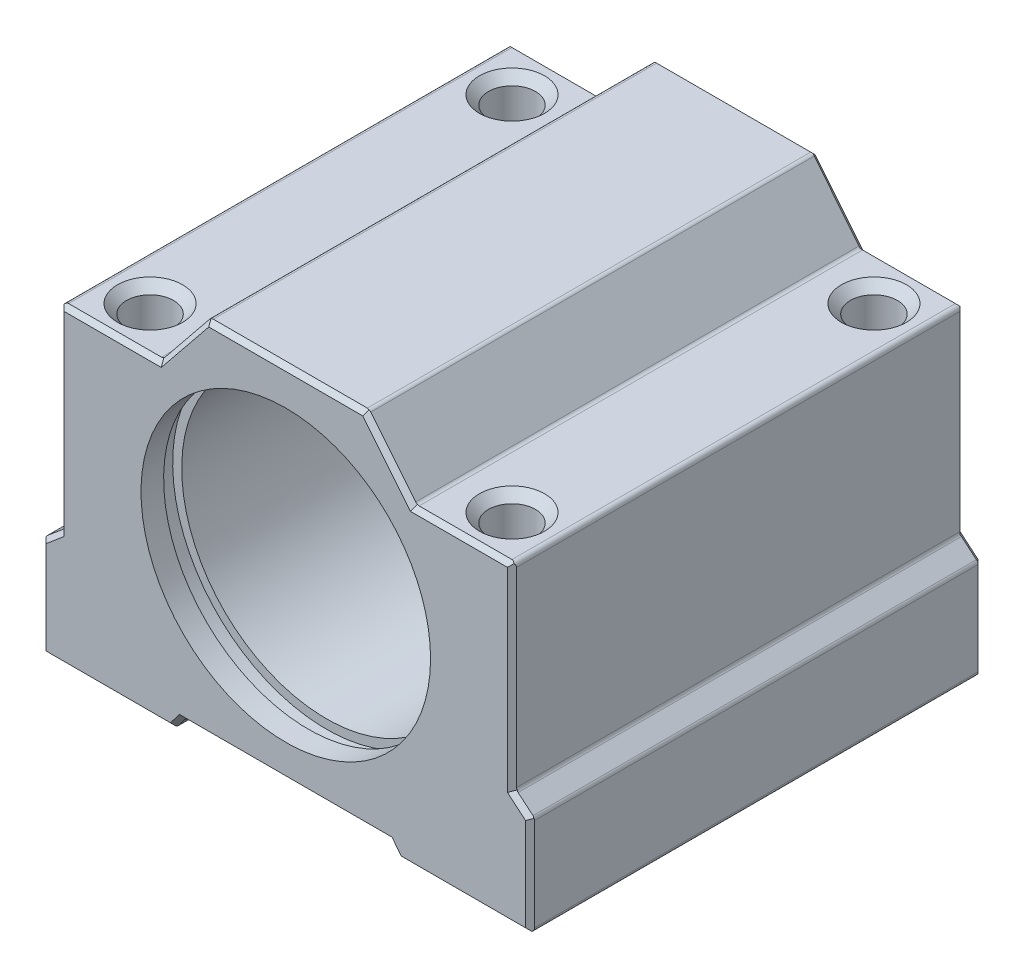
from build123d import *

# Parameters (mm, degrees)
SKETCH1_R           = 16
BOSS_EXTRUDE1_DEPTH = 50
CUT_EXTRUDE1_REACH  = 72.071
SKETCH2_R           = 2.6
SKETCH3_R           = 3
CUT_EXTRUDE2_DEPTH  = 12
SKETCH4_W           = 2
SKETCH4_H           = 1
CHAMFER1_SIZE       = 1
CHAMFER2_SIZE       = 0.5
FILLET2_R           = 0.5


with BuildPart() as part:
    # Sketch1 → Boss-Extrude1 (new body)
    with BuildSketch(Plane.XY):
        Polygon((8.75, 0), (-8.75, 0), (-14, -6.5), (-25, -6.5), (-25, -28.31372549), (-27, -30), (-27, -41), (-12.5, -41), (-11.5, -39.7), (11.5, -39.7), (12.5, -41), (27, -41), (27, -30), (25, -28.31372549), (25, -6.5), (14, -6.5), align=None)
        with Locations((0, -20)):
            Circle(SKETCH1_R, mode=Mode.SUBTRACT)
    extrude(amount=BOSS_EXTRUDE1_DEPTH)

    # Sketch2 → Cut-Extrude1 (cut, up to next)
    with BuildSketch(Plane(origin=(0, 0, 0), x_dir=(1, 0, 0), z_dir=(0, 1, 0)), mode=Mode.PRIVATE) as cut_extrude1_sk1:
        with Locations(Location((-20, -45, 0), (0, 0, 270))):
            Circle(SKETCH2_R)
    cut_extrude1_tool1 = extrude(cut_extrude1_sk1.sketch, amount=-CUT_EXTRUDE1_REACH, mode=Mode.PRIVATE) & part.part
    # Sketch2 → Cut-Extrude1 (cut, up to next)
    with BuildSketch(Plane(origin=(0, 0, 0), x_dir=(1, 0, 0), z_dir=(0, 1, 0)), mode=Mode.PRIVATE) as cut_extrude1_sk2:
        with Locations(Location((20, -45, 0), (0, 0, 270))):
            Circle(SKETCH2_R)
    cut_extrude1_tool2 = extrude(cut_extrude1_sk2.sketch, amount=-CUT_EXTRUDE1_REACH, mode=Mode.PRIVATE) & part.part
    # Sketch2 → Cut-Extrude1 (cut, up to next)
    with BuildSketch(Plane(origin=(0, 0, 0), x_dir=(1, 0, 0), z_dir=(0, 1, 0)), mode=Mode.PRIVATE) as cut_extrude1_sk3:
        with Locations(Location((20, -5, 0), (0, 0, 270))):
            Circle(SKETCH2_R)
    cut_extrude1_tool3 = extrude(cut_extrude1_sk3.sketch, amount=-CUT_EXTRUDE1_REACH, mode=Mode.PRIVATE) & part.part
    # Sketch2 → Cut-Extrude1 (cut, up to next)
    with BuildSketch(Plane(origin=(0, 0, 0), x_dir=(1, 0, 0), z_dir=(0, 1, 0)), mode=Mode.PRIVATE) as cut_extrude1_sk4:
        with Locations(Location((-20, -5, 0), (0, 0, 270))):
            Circle(SKETCH2_R)
    cut_extrude1_tool4 = extrude(cut_extrude1_sk4.sketch, amount=-CUT_EXTRUDE1_REACH, mode=Mode.PRIVATE) & part.part
    add(cut_extrude1_tool1.solids().sort_by_distance((-20, 0, 45))[0], mode=Mode.SUBTRACT)
    add(cut_extrude1_tool2.solids().sort_by_distance((20, 0, 45))[0], mode=Mode.SUBTRACT)
    add(cut_extrude1_tool3.solids().sort_by_distance((20, 0, 5))[0], mode=Mode.SUBTRACT)
    add(cut_extrude1_tool4.solids().sort_by_distance((-20, 0, 5))[0], mode=Mode.SUBTRACT)

    # Sketch3 → Cut-Extrude2 (cut)
    with BuildSketch(Plane.XZ.offset(41)):
        with Locations(Location((-20, 45, 0), (0, 0, 270))):
            Circle(SKETCH3_R)
        with Locations(Location((20, 45, 0), (0, 0, 90))):
            Circle(SKETCH3_R)
        with Locations(Location((20, 5, 0), (0, 0, 270))):
            Circle(SKETCH3_R)
        with Locations(Location((-20, 5, 0), (0, 0, 90))):
            Circle(SKETCH3_R)
    extrude(amount=-CUT_EXTRUDE2_DEPTH, mode=Mode.SUBTRACT)

    # Sketch4 → Cut-Revolve1 (revolve, cut)
    with BuildSketch(Plane(origin=(0, 0, 0), x_dir=(0, 0, -1), z_dir=(1, 0, 0))):
        with Locations((-46.5, -3.5)):
            Rectangle(SKETCH4_W, SKETCH4_H)
        with Locations((-3.5, -3.5)):
            Rectangle(SKETCH4_W, SKETCH4_H)
    revolve(axis=Axis((0, -20, 0), (0, 0, 1)), mode=Mode.SUBTRACT)

    # Chamfer1
    chamfer1_edges = [part.edges().sort_by_distance(p)[0] for p in [
        (-20, -6.5, 42.4),
        (20, -6.5, 42.4),
        (20, -6.5, 2.4),
        (-20, -6.5, 2.4),
        (-20, -41, 48),
        (20, -41, 42),
        (20, -41, 8),
        (-20, -41, 2),
    ]]
    chamfer(chamfer1_edges, length=CHAMFER1_SIZE)

    # Chamfer2
    chamfer2_edges = [part.edges().sort_by_distance(p)[0] for p in [
        (0, -39.7, 50),
        (12, -40.35, 50),
        (-27, -35.5, 0),
        (-26, -29.156862745, 0),
        (-25, -17.406862745, 0),
        (-19.5, -6.5, 0),
        (-11.375, -3.25, 0),
        (19.75, -41, 50),
        (0, 0, 0),
        (11.375, -3.25, 0),
        (19.5, -6.5, 0),
        (25, -17.406862745, 0),
        (26, -29.156862745, 0),
        (27, -35.5, 0),
        (19.75, -41, 0),
        (12, -40.35, 0),
        (27, -35.5, 50),
        (0, -39.7, 0),
        (-12, -40.35, 0),
        (-19.75, -41, 0),
        (26, -29.156862745, 50),
        (25, -17.406862745, 50),
        (19.5, -6.5, 50),
        (11.375, -3.25, 50),
        (0, 0, 50),
        (-11.375, -3.25, 50),
        (-16, -20, 0),
        (-19.75, -41, 50),
        (-19.5, -6.5, 50),
        (-25, -17.406862745, 50),
        (-26, -29.156862745, 50),
        (-27, -35.5, 50),
        (-12, -40.35, 50),
    ]]
    chamfer(chamfer2_edges, length=CHAMFER2_SIZE)

    # Fillet2
    fillet2_edges = [part.edges().sort_by_distance(p)[0] for p in [
        (14, -6.5, 25),
        (25, -6.5, 25),
        (8.75, 0, 25),
        (-8.75, 0, 25),
        (-14, -6.5, 25),
        (-25, -6.5, 25),
        (-25, -28.31372549, 25),
        (-27, -30, 25),
        (-27, -41, 25),
        (-12.5, -41, 25),
        (-11.5, -39.7, 25),
        (11.5, -39.7, 25),
        (12.5, -41, 25),
        (27, -41, 25),
        (27, -30, 25),
        (25, -28.31372549, 25),
    ]]
    fillet(fillet2_edges, radius=FILLET2_R)


solid = part.part
